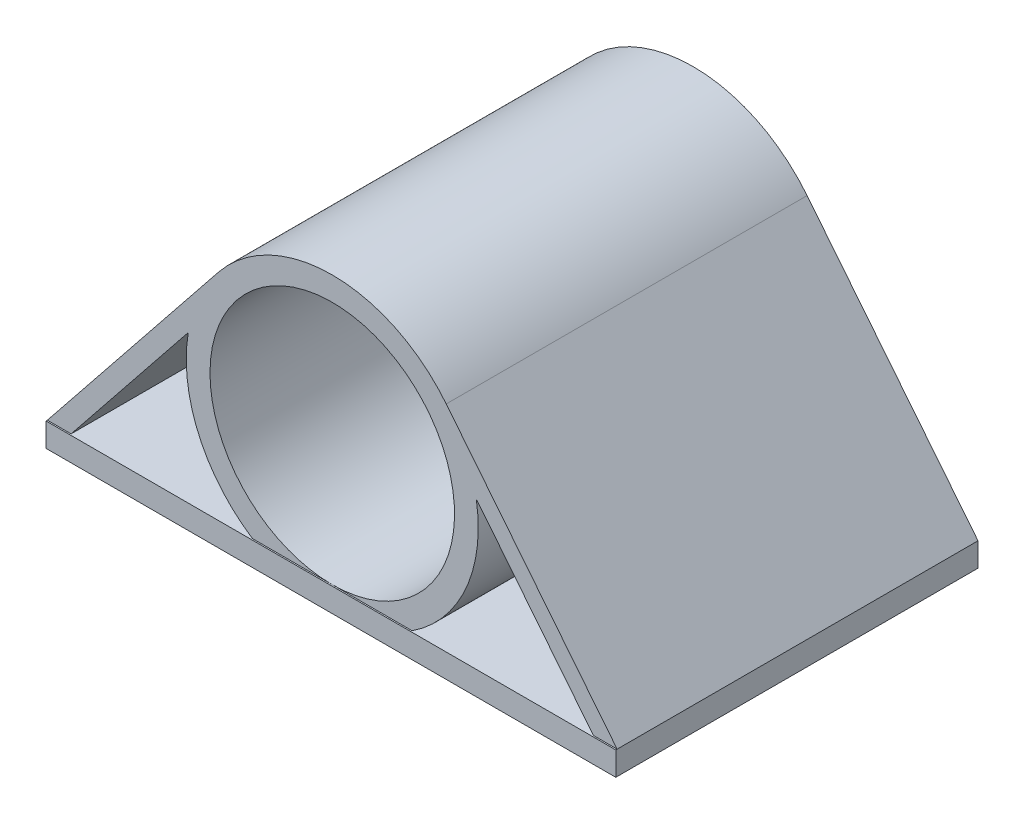
from build123d import *

# Parameters (mm, degrees)
SKETCH1_R           = 30.75
SKETCH1_R_2         = 25.75
BOSS_EXTRUDE2_DEPTH = 76
SKETCH2_R           = 25.75
BOSS_EXTRUDE3_DEPTH = 5
SKETCH3_R           = 10.75
CUT_EXTRUDE1_DEPTH  = 5
SKETCH8_R           = 2.75
CUT_EXTRUDE3_DEPTH  = 5
SKETCH9_W           = 120
SKETCH9_H           = 76.288316085
BOSS_EXTRUDE4_DEPTH = 5
BOSS_EXTRUDE5_DEPTH = 76


with BuildPart() as part:
    # Sketch1 → Boss-Extrude2 (new body)
    with BuildSketch(Plane.XY):
        Circle(SKETCH1_R)
        Circle(SKETCH1_R_2, mode=Mode.SUBTRACT)
    extrude(amount=BOSS_EXTRUDE2_DEPTH)

    # Sketch2 → Boss-Extrude3 (add)
    with BuildSketch(Plane(origin=(0, 0, 0), x_dir=(-1, 0, 0), z_dir=(0, 0, -1))):
        Circle(SKETCH2_R)
    extrude(amount=-BOSS_EXTRUDE3_DEPTH)

    # Sketch3 → Cut-Extrude1 (cut)
    with BuildSketch(Plane(origin=(0, 0, 0), x_dir=(-1, 0, 0), z_dir=(0, 0, -1))):
        Circle(SKETCH3_R)
    extrude(amount=-CUT_EXTRUDE1_DEPTH, mode=Mode.SUBTRACT)

    # Sketch8 → Cut-Extrude3 (cut)
    with BuildSketch(Plane(origin=(0, 0, 0), x_dir=(-1, 0, 0), z_dir=(0, 0, -1))):
        with Locations((20, 0)):
            Circle(SKETCH8_R)
        with Locations(Location((-20, 0, 0), (0, 0, 180))):
            Circle(SKETCH8_R)
    extrude(amount=-CUT_EXTRUDE3_DEPTH, mode=Mode.SUBTRACT)

    # Sketch9 → Boss-Extrude4 (add)
    with BuildSketch(Plane(origin=(0, -30.75, 0), x_dir=(1, 0, 0), z_dir=(0, 1, 0))):
        with Locations((0, -38.144158043)):
            Rectangle(SKETCH9_W, SKETCH9_H)
    extrude(amount=BOSS_EXTRUDE4_DEPTH)

    # Sketch11 → Boss-Extrude5 (add, through all)
    with BuildSketch(Plane.XY.offset(76)):
        Polygon((-60, -25.75), (-24.006301312, 19.21613898), (-30.32899646, 5.070944065), (-55, -25.75), align=None)
        Polygon((55, -25.75), (30.32899646, 5.070944065), (24.006301312, 19.21613898), (60, -25.75), align=None)
    extrude(amount=-BOSS_EXTRUDE5_DEPTH)


solid = part.part
